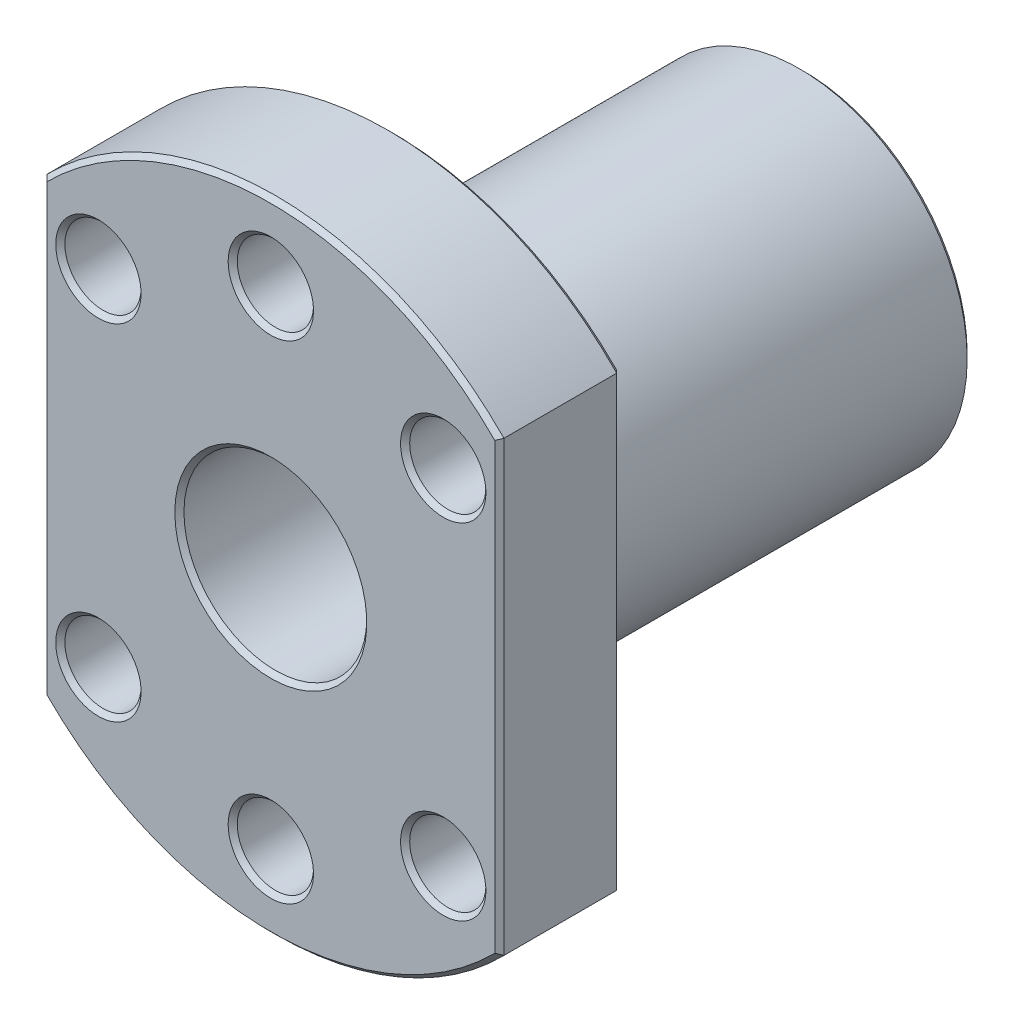
from build123d import *

# Parameters (mm, degrees)
CUT_EXTRUDE1_DEPTH      = 35.471002306
CUT_EXTRUDE1_DEPTH_BACK = 35.471002306
SKETCH2_W               = 6
SKETCH2_H               = 8
SKETCH3_R               = 2.5
CUT_EXTRUDE2_DEPTH      = 10
CHAMFER1_SIZE           = 0.3


with BuildPart() as part:
    # Sketch1 → Revolve1 (revolve)
    with BuildSketch(Plane(origin=(0, 0, 0), x_dir=(0, 0, -1), z_dir=(1, 0, 0)), mode=Mode.PRIVATE) as revolve1_sk:
        Polygon((17.5, 6), (-17.5, 6), (-17.5, 21), (-9.5, 21), (-9.5, 11), (17.5, 11), align=None)
    revolve(revolve1_sk.sketch.rotate(Axis((0, 0, 27), (0, 0, -1)), 90), axis=Axis((0, 0, 27), (0, 0, -1)))

    # Sketch2 → Cut-Extrude1 (cut, two sides: drawn at the far end of the back side and taken through both)
    with BuildSketch(Plane(origin=(0, 0, 0), x_dir=(1, 0, 0), z_dir=(0, 1, 0)).offset(-CUT_EXTRUDE1_DEPTH_BACK)):
        with Locations((-18, -13.5)):
            Rectangle(SKETCH2_W, SKETCH2_H)
        with Locations((18, -13.5)):
            Rectangle(SKETCH2_W, SKETCH2_H)
    extrude(amount=CUT_EXTRUDE1_DEPTH + CUT_EXTRUDE1_DEPTH_BACK, mode=Mode.SUBTRACT)

    # Sketch3 → Cut-Extrude2 (cut)
    with BuildSketch(Plane.XY.offset(17.5)):
        with Locations((0, 16)):
            Circle(SKETCH3_R)
        with Locations((11.313708499, 11.313708499)):
            Circle(SKETCH3_R)
        with Locations((11.313708499, -11.313708499)):
            Circle(SKETCH3_R)
        with Locations((0, -16)):
            Circle(SKETCH3_R)
        with Locations((-11.313708499, -11.313708499)):
            Circle(SKETCH3_R)
        with Locations((-11.313708499, 11.313708499)):
            Circle(SKETCH3_R)
    extrude(amount=-CUT_EXTRUDE2_DEPTH, mode=Mode.SUBTRACT)

    # Chamfer1
    chamfer1_edges = [part.edges().sort_by_distance(p)[0] for p in [
        (0, -21, 9.5),
        (-15, 0, 9.5),
        (0, -21, 17.5),
        (-15, 0, 17.5),
        (0, 21, 9.5),
        (15, 0, 9.5),
        (0, 21, 17.5),
        (15, 0, 17.5),
        (-11, 0, -17.5),
        (-11, 0, 9.5),
        (-2.5, 16, 9.5),
        (-2.5, 16, 17.5),
        (8.813708499, 11.313708499, 9.5),
        (-6, 0, 17.5),
        (8.813708499, 11.313708499, 17.5),
        (8.813708499, -11.313708499, 9.5),
        (8.813708499, -11.313708499, 17.5),
        (-2.5, -16, 9.5),
        (-6, 0, -17.5),
        (-2.5, -16, 17.5),
        (-13.813708499, -11.313708499, 9.5),
        (-13.813708499, -11.313708499, 17.5),
        (-13.813708499, 11.313708499, 9.5),
        (-13.813708499, 11.313708499, 17.5),
    ]]
    chamfer(chamfer1_edges, length=CHAMFER1_SIZE)


solid = part.part
